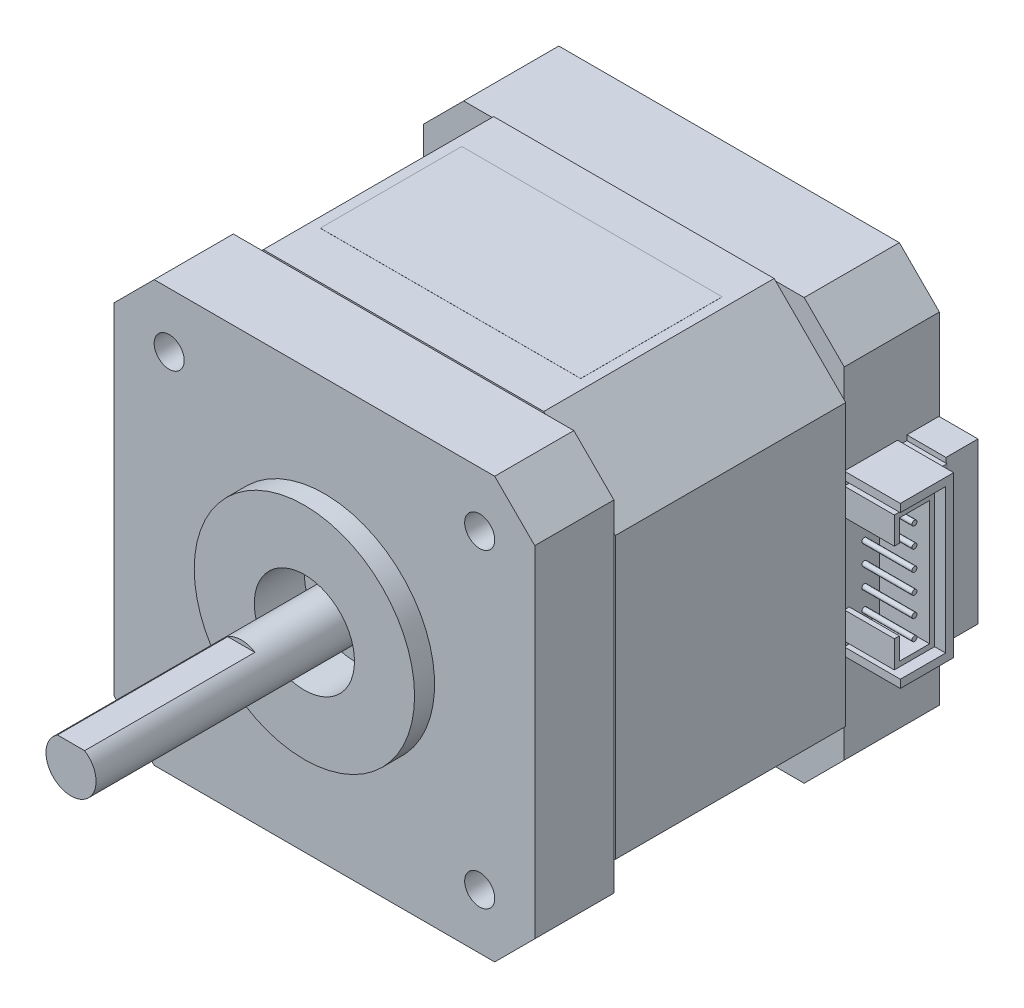
from build123d import *

# Parameters (mm, degrees)
BOSS_EXTRUDE1_DEPTH  = 9.5
BOSS_EXTRUDE2_DEPTH  = 23
BOSS_EXTRUDE3_DEPTH  = 7.9
SKETCH5_R            = 11
SKETCH5_R_2          = 5
BOSS_EXTRUDE4_DEPTH  = 2
CUT_EXTRUDE1_START   = -3
SKETCH6_R            = 5
CUT_EXTRUDE1_DEPTH   = 3
SKETCH7_R            = 2.5
BOSS_EXTRUDE5_DEPTH  = 5
SKETCH8_R            = 2.5
BOSS_EXTRUDE6_DEPTH  = 23.3
CUT_EXTRUDE2_DEPTH   = 17
SKETCH10_W           = 26
SKETCH10_H           = 14.120419237
BOSS_EXTRUDE7_DEPTH  = 0.01
SKETCH11_W           = 3.2
SKETCH11_H           = 16
BOSS_EXTRUDE8_DEPTH  = 3.9
BOSS_EXTRUDE9_DEPTH  = 5.6
SKETCH13_W           = 0.930512921
SKETCH13_H           = 15
BOSS_EXTRUDE10_DEPTH = 3.9
SKETCH14_W           = 0.930512921
SKETCH14_H           = 15
BOSS_EXTRUDE11_DEPTH = 0.1
BOSS_EXTRUDE12_DEPTH = 5
SKETCH16_R           = 0.25
BOSS_EXTRUDE13_DEPTH = 5
SKETCH17_R           = 1.5
CUT_EXTRUDE3_DEPTH   = 5.5
SKETCH18_R           = 3.25
CUT_EXTRUDE4_DEPTH   = 3
CUT_EXTRUDE5_START   = -4
SKETCH20_R           = 1.5
CUT_EXTRUDE5_DEPTH   = 4
SKETCH21_R           = 4.5
CUT_EXTRUDE6_DEPTH   = 4


with BuildPart() as part:
    # Sketch1 → Boss-Extrude1 (new body)
    with BuildSketch(Plane.XY):
        Polygon((-17, 21), (-21, 17), (-21, -17), (-17, -21), (17, -21), (21, -17), (21, 17), (17, 21), align=None)
    extrude(amount=BOSS_EXTRUDE1_DEPTH)

    # Sketch2 → Boss-Extrude2 (add)
    with BuildSketch(Plane.XY.offset(9.5)):
        Polygon((14, 21.15), (21.15, 14), (21.15, -14), (14, -21.15), (-14, -21.15), (-21.15, -14), (-21.15, 14), (-14, 21.15), align=None)
    extrude(amount=BOSS_EXTRUDE2_DEPTH)

    # Sketch3 → Boss-Extrude3 (add)
    with BuildSketch(Plane.XY.offset(32.5)):
        Polygon((-17, 21), (17, 21), (21, 17), (21, -17), (17, -21), (-17, -21), (-21, -17), (-21, 17), align=None)
    extrude(amount=BOSS_EXTRUDE3_DEPTH)

    # Sketch5 → Boss-Extrude4 (add)
    with BuildSketch(Plane.XY.offset(40.4)):
        with Locations(Location((0, 0, 0), (0, 0, 180))):
            Circle(SKETCH5_R)
        Circle(SKETCH5_R_2, mode=Mode.SUBTRACT)
    extrude(amount=BOSS_EXTRUDE4_DEPTH)

    # Sketch6 → Cut-Extrude1 (cut)
    with BuildSketch(Plane.XY.offset(40.4).offset(CUT_EXTRUDE1_START)):
        Circle(SKETCH6_R)
    extrude(amount=CUT_EXTRUDE1_DEPTH, mode=Mode.SUBTRACT)

    # Sketch7 → Boss-Extrude5 (add)
    with BuildSketch(Plane.XY.offset(37.4)):
        with Locations(Location((0, 0, 0), (0, 0, 180))):
            Circle(SKETCH7_R)
    extrude(amount=BOSS_EXTRUDE5_DEPTH)

    # Sketch8 → Boss-Extrude6 (add)
    with BuildSketch(Plane.XY.offset(42.4)):
        with Locations(Location((0, 0, 0), (0, 0, 180))):
            Circle(SKETCH8_R)
    extrude(amount=BOSS_EXTRUDE6_DEPTH)

    # Sketch9 → Cut-Extrude2 (cut)
    with BuildSketch(Plane.XY.offset(65.7)):
        Polygon((-2.316645086, 2.1), (3.697939095, 2.1), (-0.123554347, 3.991048302), align=None)
    extrude(amount=-CUT_EXTRUDE2_DEPTH, mode=Mode.SUBTRACT)

    # Sketch10 → Boss-Extrude7 (add)
    with BuildSketch(Plane(origin=(0, 21.15, 0), x_dir=(1, 0, 0), z_dir=(0, 1, 0))):
        with Locations((0, -20.751085576)):
            Rectangle(SKETCH10_W, SKETCH10_H)
    extrude(amount=BOSS_EXTRUDE7_DEPTH)

    # Sketch11 → Boss-Extrude8 (add)
    with BuildSketch(Plane(origin=(21, 0, 0), x_dir=(0, 0, -1), z_dir=(1, 0, 0))):
        with Locations((-1.645589959, 0)):
            Rectangle(SKETCH11_W, SKETCH11_H)
    extrude(amount=BOSS_EXTRUDE8_DEPTH)

    # Sketch12 → Boss-Extrude9 (add)
    with BuildSketch(Plane(origin=(21, 0, 0), x_dir=(0, 0, -1), z_dir=(1, 0, 0))):
        Polygon((-9.5, 7.2), (-4.97610288, 7.2), (-4.97610288, -7.2), (-9.5, -7.2), (-9.5, -8), (-4.17610288, -8), (-4.17610288, -7.2), (-4.17610288, 7.2), (-4.17610288, 8), (-9.5, 8), align=None)
    extrude(amount=BOSS_EXTRUDE9_DEPTH)

    # Sketch13 → Boss-Extrude10 (add)
    with BuildSketch(Plane(origin=(21, 0, 0), x_dir=(0, 0, -1), z_dir=(1, 0, 0))):
        with Locations((-3.71084642, 0)):
            Rectangle(SKETCH13_W, SKETCH13_H)
    extrude(amount=BOSS_EXTRUDE10_DEPTH)

    # Sketch14 → Boss-Extrude11 (add)
    with BuildSketch(Plane(origin=(24.9, 0, 0), x_dir=(0, 0, -1), z_dir=(1, 0, 0))):
        with Locations((-3.71084642, 0)):
            Rectangle(SKETCH14_W, SKETCH14_H)
    extrude(amount=BOSS_EXTRUDE11_DEPTH)

    # Sketch15 → Boss-Extrude12 (add)
    with BuildSketch(Plane(origin=(21, 0, 0), x_dir=(0, 0, -1), z_dir=(1, 0, 0))):
        Polygon((-5.97610288, 6.2), (-9, 6.2), (-9, 4), (-9.5, 4), (-9.5, 6.7), (-9, 6.7), (-5.47610288, 6.7), (-5.47610288, -6.7), (-9, -6.7), (-9.5, -6.7), (-9.5, -4), (-9, -4), (-9, -6.2), (-5.97610288, -6.2), align=None)
    extrude(amount=BOSS_EXTRUDE12_DEPTH)

    # Sketch16 → Boss-Extrude13 (add)
    with BuildSketch(Plane(origin=(21, 0, 0), x_dir=(0, 0, -1), z_dir=(1, 0, 0))):
        with Locations(Location((-7.48805144, 5, 0), (0, 0, 270))):
            Circle(SKETCH16_R)
        with Locations(Location((-7.48805144, 3, 0), (0, 0, 270))):
            Circle(SKETCH16_R)
        with Locations(Location((-7.48805144, 1, 0), (0, 0, 270))):
            Circle(SKETCH16_R)
        with Locations(Location((-7.48805144, -1, 0), (0, 0, 270))):
            Circle(SKETCH16_R)
        with Locations(Location((-7.48805144, -3, 0), (0, 0, 270))):
            Circle(SKETCH16_R)
        with Locations(Location((-7.48805144, -5, 0), (0, 0, 270))):
            Circle(SKETCH16_R)
    extrude(amount=BOSS_EXTRUDE13_DEPTH)

    # Sketch17 → Cut-Extrude3 (cut)
    with BuildSketch(Plane.XY.offset(40.4)):
        with Locations((-15.5, 15.5)):
            Circle(SKETCH17_R)
        with Locations((15.5, 15.5)):
            Circle(SKETCH17_R)
        with Locations((15.5, -15.5)):
            Circle(SKETCH17_R)
        with Locations((-15.5, -15.5)):
            Circle(SKETCH17_R)
    extrude(amount=-CUT_EXTRUDE3_DEPTH, mode=Mode.SUBTRACT)

    # Sketch18 → Cut-Extrude4 (cut)
    with BuildSketch(Plane(origin=(0, 0, 0), x_dir=(-1, 0, 0), z_dir=(0, 0, -1))):
        with Locations((-15.5, 15.5)):
            Circle(SKETCH18_R)
        with Locations((15.5, 15.5)):
            Circle(SKETCH18_R)
        with Locations((15.5, -15.5)):
            Circle(SKETCH18_R)
        with Locations((-15.5, -15.5)):
            Circle(SKETCH18_R)
    extrude(amount=-CUT_EXTRUDE4_DEPTH, mode=Mode.SUBTRACT)

    # Sketch20 → Cut-Extrude5 (cut)
    with BuildSketch(Plane(origin=(0, 0, 3), x_dir=(-1, 0, 0), z_dir=(0, 0, -1)).offset(CUT_EXTRUDE5_START)):
        with Locations(Location((-15.5, 15.5, 0), (0, 0, 180))):
            Circle(SKETCH20_R)
        with Locations(Location((15.5, 15.5, 0), (0, 0, 180))):
            Circle(SKETCH20_R)
        with Locations(Location((-15.5, -15.5, 0), (0, 0, 180))):
            Circle(SKETCH20_R)
        with Locations(Location((15.5, -15.5, 0), (0, 0, 180))):
            Circle(SKETCH20_R)
    extrude(amount=CUT_EXTRUDE5_DEPTH, mode=Mode.SUBTRACT)

    # Sketch21 → Cut-Extrude6 (cut)
    with BuildSketch(Plane(origin=(0, 0, 0), x_dir=(-1, 0, 0), z_dir=(0, 0, -1))):
        Circle(SKETCH21_R)
    extrude(amount=-CUT_EXTRUDE6_DEPTH, mode=Mode.SUBTRACT)


solid = part.part
